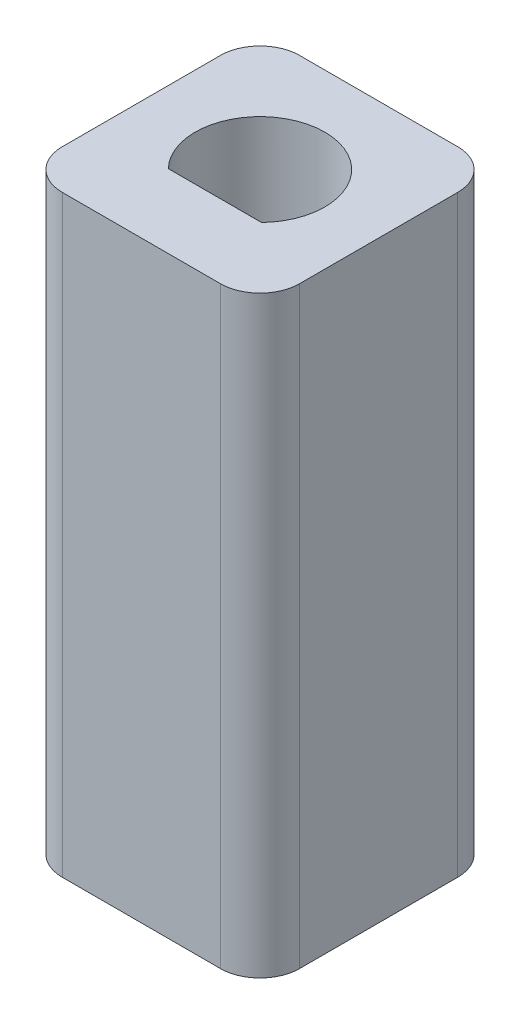
from build123d import *

# Parameters (mm, degrees)
SKETCH2_W           = 6
SKETCH2_H           = 6
BOSS_EXTRUDE1_DEPTH = 8
SKETCH7_W           = 6
SKETCH7_H           = 6
BOSS_EXTRUDE2_DEPTH = 7
FILLET1_R           = 1


with BuildPart() as part:
    # Sketch2 → Boss-Extrude1 (new body)
    with BuildSketch(Plane(origin=(0, 0, 0), x_dir=(1, 0, 0), z_dir=(0, 1, 0))):
        Rectangle(SKETCH2_W, SKETCH2_H)
        with BuildLine():
            Line((-1.178982612, -1.14), (1.178982612, -1.14))
            ThreePointArc((1.178982612, -1.14), (0, 1.64), (-1.178982612, -1.14))
        make_face(mode=Mode.SUBTRACT)
    extrude(amount=BOSS_EXTRUDE1_DEPTH)

    # Sketch7 → Boss-Extrude2 (add)
    with BuildSketch(Plane(origin=(0, 0, 0), x_dir=(-1, 0, 0), z_dir=(0, -1, 0))):
        Rectangle(SKETCH7_W, SKETCH7_H)
        with BuildLine():
            Line((-2.35, -0.935), (-1.435, -0.935))
            ThreePointArc((-1.435, -0.935), (-1.081446609, -1.081446609), (-0.935, -1.435))
            Line((-0.935, -1.435), (-0.935, -2.35))
            ThreePointArc((-0.935, -2.35), (0, -2.529174767), (0.935, -2.35))
            Line((0.935, -2.35), (0.935, -1.435))
            ThreePointArc((0.935, -1.435), (1.081446609, -1.081446609), (1.435, -0.935))
            Line((1.435, -0.935), (2.35, -0.935))
            ThreePointArc((2.35, -0.935), (2.529174767, 0), (2.35, 0.935))
            Line((2.35, 0.935), (1.435, 0.935))
            ThreePointArc((1.435, 0.935), (1.081446609, 1.081446609), (0.935, 1.435))
            Line((0.935, 1.435), (0.935, 2.35))
            ThreePointArc((0.935, 2.35), (0, 2.529174767), (-0.935, 2.35))
            Line((-0.935, 2.35), (-0.935, 1.435))
            ThreePointArc((-0.935, 1.435), (-1.081446609, 1.081446609), (-1.435, 0.935))
            Line((-1.435, 0.935), (-2.35, 0.935))
            ThreePointArc((-2.35, 0.935), (-2.529174767, 0), (-2.35, -0.935))
        make_face(mode=Mode.SUBTRACT)
    extrude(amount=BOSS_EXTRUDE2_DEPTH)

    # Fillet1
    fillet1_edges = [part.edges().sort_by_distance(p)[0] for p in [
        (3, 0.5, 3),
        (-3, 0.5, 3),
        (-3, 0.5, -3),
        (3, 0.5, -3),
    ]]
    fillet(fillet1_edges, radius=FILLET1_R)


solid = part.part
